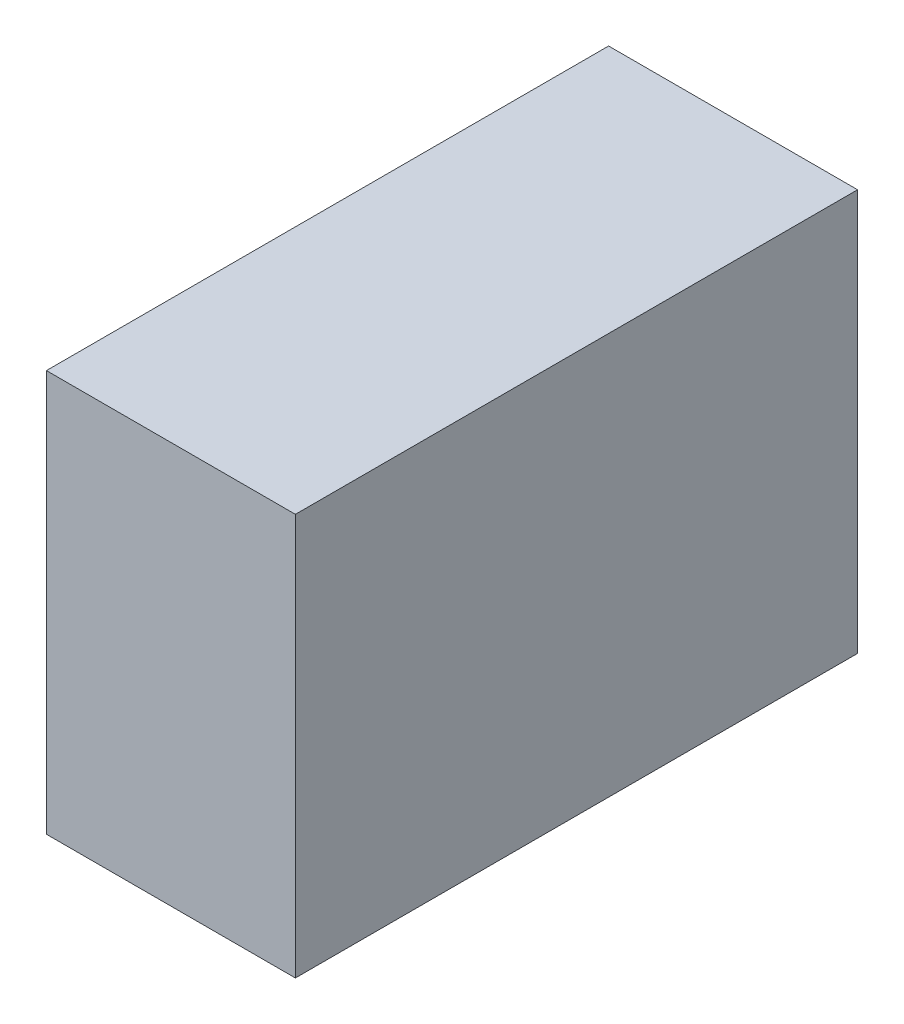
from build123d import *

# Parameters (mm, degrees)
SKETCH1_W           = 39.37
SKETCH1_H           = 88.9
BOSS_EXTRUDE1_DEPTH = 31.75


with BuildPart() as part:
    # Sketch1 → Boss-Extrude1 (new, symmetric)
    with BuildSketch(Plane(origin=(0, 0, 0), x_dir=(1, 0, 0), z_dir=(0, 1, 0))):
        Rectangle(SKETCH1_W, SKETCH1_H)
    extrude(amount=BOSS_EXTRUDE1_DEPTH, both=True)


solid = part.part
